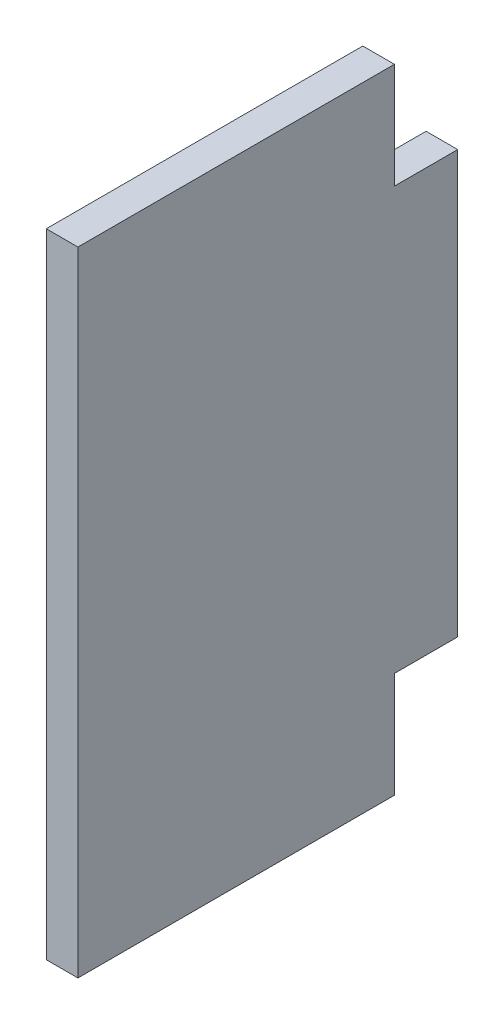
from build123d import *

# Parameters (mm, degrees)
ESTRUSIONE_ESTRUSIONE1_DEPTH      = 30
ESTRUSIONE_ESTRUSIONE1_DEPTH_BACK = 6
SCHIZZO1_W                        = 3
SCHIZZO1_H                        = 40
SCHIZZO2_W                        = 3
SCHIZZO2_H                        = 30
ESTRUSIONE_ESTRUSIONE2_DEPTH      = 10


with BuildPart() as part:
    # Schizzo1 → Estrusione-Estrusione1 (new, two sides: drawn at the far end of the back side and taken through both)
    with BuildSketch(Plane.XY.offset(1).offset(-ESTRUSIONE_ESTRUSIONE1_DEPTH_BACK)):
        with Locations((71.042298103, 0)):
            Rectangle(SCHIZZO1_W, SCHIZZO1_H)
    extrude(amount=ESTRUSIONE_ESTRUSIONE1_DEPTH + ESTRUSIONE_ESTRUSIONE1_DEPTH_BACK)

    # Schizzo2 → Estrusione-Estrusione2 (add)
    with BuildSketch(Plane(origin=(0, 20, 0), x_dir=(1, 0, 0), z_dir=(0, 1, 0))):
        with Locations((71.042298103, -16)):
            Rectangle(SCHIZZO2_W, SCHIZZO2_H)
    estrusione_estrusione2 = extrude(amount=ESTRUSIONE_ESTRUSIONE2_DEPTH)

    # Specchia1: Estrusione-Estrusione2 across plane
    add(estrusione_estrusione2.mirror(Plane.ZX))


solid = part.part
